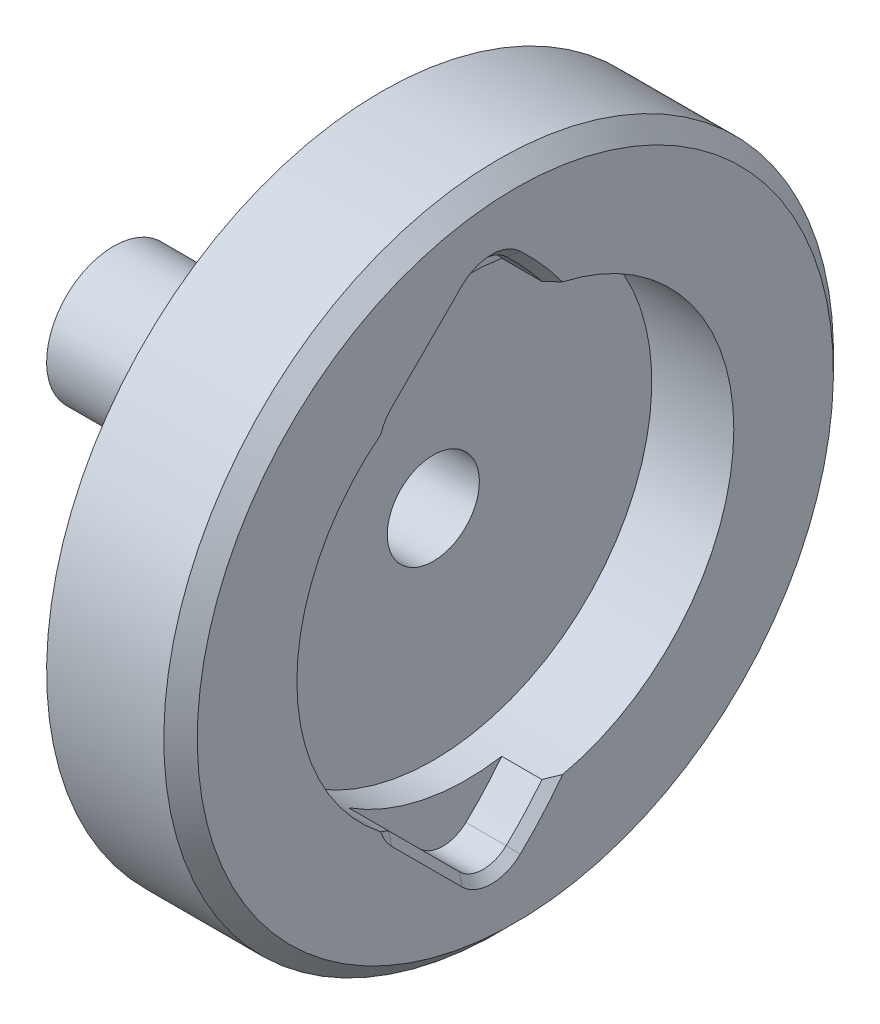
from build123d import *

# Parameters (mm, degrees)
CORTAR_EXTRUIR1_DEPTH = 2.9
REDONDEO1_R           = 10
CORTAR_EXTRUIR2_REACH = 39.094
CROQUIS3_R            = 1.75
CROQUIS4_R            = 2.75
CORTAR_EXTRUIR3_DEPTH = 18.1
CHAFL_N1_SIZE         = 1
CHAFL_N2_SIZE         = 0.5
CROQUIS5_R            = 13.05
CORTAR_EXTRUIR4_DEPTH = 4.9


with BuildPart() as part:
    # Croquis1 → Revolución1 (revolve)
    with BuildSketch(Plane.XY):
        Polygon((-16, 0), (-16, 4), (0, 4), (0, 20), (8, 20), (8, 0), align=None)
    revolve(axis=Axis((8, 0, 0), (-1, 0, 0)))

    # Croquis2 → Cortar-Extruir1 (cut)
    with BuildSketch(Plane(origin=(8, 0, 0), x_dir=(0, 0, -1), z_dir=(1, 0, 0))):
        with BuildLine():
            Line((-2.839199656, 15.194118815), (-7.049029232, 10.984289239))
            ThreePointArc((-7.049029232, 10.984289239), (-7.634375098, 9.528098398), (-6.988431485, 8.097756342))
            ThreePointArc((-6.988431485, 8.097756342), (-3.433318471, 0), (-6.988431485, -8.097756342))
            ThreePointArc((-6.988431485, -8.097756342), (-7.634375098, -9.528098398), (-7.049029232, -10.984289239))
            Line((-7.049029232, -10.984289239), (-2.839199656, -15.194118815))
            ThreePointArc((-2.839199656, -15.194118815), (-1.453779812, -15.779697972), (-0.052075025, -15.234248815))
            ThreePointArc((-0.052075025, -15.234248815), (6.516681529, 0), (-0.052075025, 15.234248815))
            ThreePointArc((-0.052075025, 15.234248815), (-1.453779812, 15.779697972), (-2.839199656, 15.194118815))
        make_face()
    extrude(amount=-CORTAR_EXTRUIR1_DEPTH, mode=Mode.SUBTRACT)

    # Redondeo1
    redondeo1_edges = [part.edges().sort_by_distance(p)[0] for p in [
        (0, -4, 0),
    ]]
    fillet(redondeo1_edges, radius=REDONDEO1_R)

    # Croquis3 → Cortar-Extruir2 (cut, up to next)
    with BuildSketch(Plane.ZY.offset(16), mode=Mode.PRIVATE) as cortar_extruir2_sk1:
        with Locations(Location((0, 0, 0), (0, 0, 270))):
            Circle(CROQUIS3_R)
    cortar_extruir2_tool1 = extrude(cortar_extruir2_sk1.sketch, amount=-CORTAR_EXTRUIR2_REACH, mode=Mode.PRIVATE) & part.part
    add(cortar_extruir2_tool1.solids().sort_by_distance((-16, 0, 0))[0], mode=Mode.SUBTRACT)

    # Croquis4 → Cortar-Extruir3 (cut)
    with BuildSketch(Plane(origin=(5.1, 0, 0), x_dir=(0, 0, -1), z_dir=(1, 0, 0))):
        with Locations(Location((0, 0, 0), (0, 0, 90))):
            Circle(CROQUIS4_R)
    extrude(amount=-CORTAR_EXTRUIR3_DEPTH, mode=Mode.SUBTRACT)

    # Chaflán1
    chafl_n1_edges = [part.edges().sort_by_distance(p)[0] for p in [
        (8, -20, 0),
    ]]
    chamfer(chafl_n1_edges, length=CHAFL_N1_SIZE)

    # Chaflán2
    chafl_n2_edges = [part.edges().sort_by_distance(p)[0] for p in [
        (8, -15.779697972, 1.453779812),
        (8, 0, -6.516681529),
        (8, 15.779697972, 1.453779812),
        (8, 13.089204027, 4.944114444),
        (8, 9.528098398, 7.634375098),
        (8, 0, 3.433318471),
        (8, -9.528098398, 7.634375098),
        (8, -13.089204027, 4.944114444),
    ]]
    chamfer(chafl_n2_edges, length=CHAFL_N2_SIZE)

    # Croquis5 → Cortar-Extruir4 (cut)
    with BuildSketch(Plane(origin=(8, 0, 0), x_dir=(0, 0, -1), z_dir=(1, 0, 0))):
        with Locations(Location((0, 0, 0), (0, 0, 80.792213194))):
            Circle(CROQUIS5_R)
    extrude(amount=-CORTAR_EXTRUIR4_DEPTH, mode=Mode.SUBTRACT)


solid = part.part
